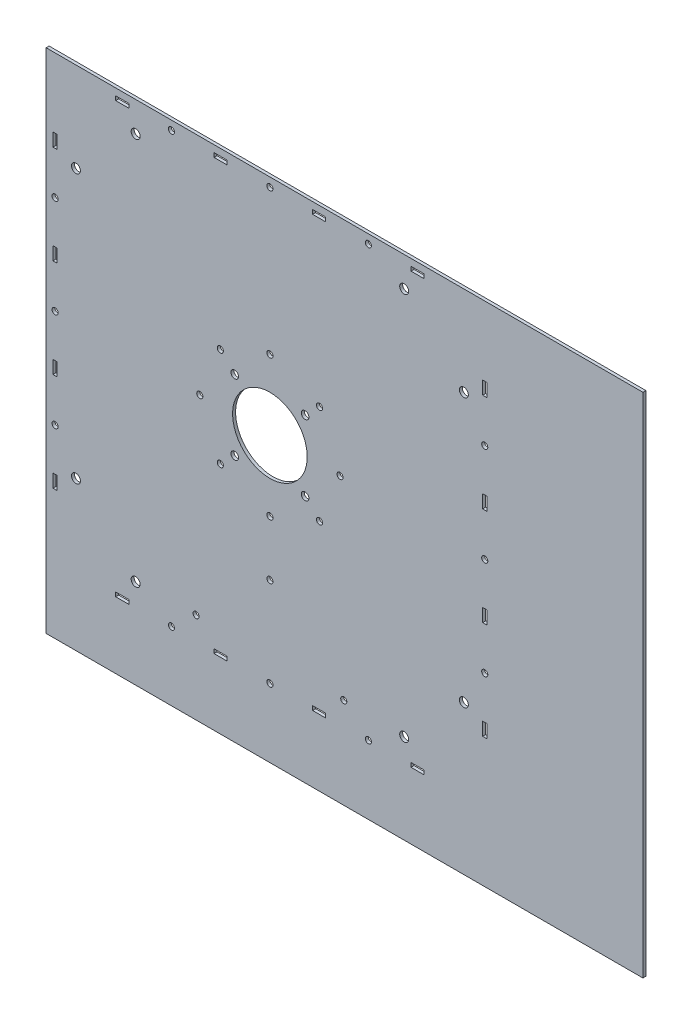
from build123d import *

# Parameters (mm, degrees)
SKETCH_1_R          = 25
SKETCH_1_R_2        = 2.55
EXTRUDE_1_DEPTH     = 2
SKETCH_3_R          = 2.05
SKETCH_3_W          = 8.8
SKETCH_3_H          = 2.8
SKETCH_3_W_2        = 2.8
SKETCH_3_H_2        = 8.8
CUT_EXTRUDE_2_DEPTH = 4
SKETCH_7_R          = 3
CUT_EXTRUDE_3_DEPTH = 10
EXTRUDE_3_DEPTH     = 2


with BuildPart() as part:
    # 草图1 → 凸台-拉伸1 (new body)
    with BuildSketch(Plane.XY):
        Polygon((151.457142857, -41.187142857), (151.457142857, 108.812857143), (-148.542857143, 108.812857143), (-148.542857143, -191.187142857), (151.457142857, -191.187142857), align=None)
        with Locations((1.457142857, -41.187142857)):
            Circle(SKETCH_1_R, mode=Mode.SUBTRACT)
        with Locations((25.027142857, -17.617142857)):
            Circle(SKETCH_1_R_2, mode=Mode.SUBTRACT)
        with Locations((25.027142857, -64.757142857)):
            Circle(SKETCH_1_R_2, mode=Mode.SUBTRACT)
        with Locations((-22.112857143, -64.757142857)):
            Circle(SKETCH_1_R_2, mode=Mode.SUBTRACT)
        with Locations((-22.112857143, -17.617142857)):
            Circle(SKETCH_1_R_2, mode=Mode.SUBTRACT)
    extrude(amount=EXTRUDE_1_DEPTH)

    # 草图3 → 切除-拉伸2 (cut)
    with BuildSketch(Plane.XY.offset(2)):
        with Locations((1.457142857, -185.187142857)):
            Circle(SKETCH_3_R)
        with Locations((67.457142857, -185.187142857)):
            Circle(SKETCH_3_R)
        with Locations((-64.542857143, -185.187142857)):
            Circle(SKETCH_3_R)
        with Locations((-142.542857143, 24.812857143)):
            Circle(SKETCH_3_R)
        with Locations((-142.542857143, -41.187142857)):
            Circle(SKETCH_3_R)
        with Locations((-142.542857143, -107.187142857)):
            Circle(SKETCH_3_R)
        with Locations((67.457142857, 102.812857143)):
            Circle(SKETCH_3_R)
        with Locations((1.457142857, 102.812857143)):
            Circle(SKETCH_3_R)
        with Locations((-64.542857143, 102.812857143)):
            Circle(SKETCH_3_R)
        with Locations((145.457142857, -107.187142857)):
            Circle(SKETCH_3_R)
        with Locations((145.457142857, -41.187142857)):
            Circle(SKETCH_3_R)
        with Locations((145.457142857, 24.812857143)):
            Circle(SKETCH_3_R)
        with Locations((50.957142857, -170.187142857)):
            Circle(SKETCH_3_R)
        with Locations((-48.042857143, -170.187142857)):
            Circle(SKETCH_3_R)
        with Locations((1.457142857, -88.187142857)):
            Circle(SKETCH_3_R)
        with Locations((-31.776875859, -74.421161573)):
            Circle(SKETCH_3_R)
        with Locations((-45.542857143, -41.187142857)):
            Circle(SKETCH_3_R)
        with Locations((-31.776875859, -7.953124141)):
            Circle(SKETCH_3_R)
        with Locations((1.457142857, 5.812857143)):
            Circle(SKETCH_3_R)
        with Locations((34.691161573, -7.953124141)):
            Circle(SKETCH_3_R)
        with Locations((48.457142857, -41.187142857)):
            Circle(SKETCH_3_R)
        with Locations((34.691161573, -74.421161573)):
            Circle(SKETCH_3_R)
        with Locations((1.457142857, -125.187142857)):
            Circle(SKETCH_3_R)
        with Locations((100.457142857, -185.187142857)):
            Rectangle(SKETCH_3_W, SKETCH_3_H)
        with Locations((34.457142857, -185.187142857)):
            Rectangle(SKETCH_3_W, SKETCH_3_H)
        with Locations((-31.542857143, -185.187142857)):
            Rectangle(SKETCH_3_W, SKETCH_3_H)
        with Locations((-97.542857143, -185.187142857)):
            Rectangle(SKETCH_3_W, SKETCH_3_H)
        with Locations((-142.542857143, 57.812857143)):
            Rectangle(SKETCH_3_W_2, SKETCH_3_H_2)
        with Locations((-142.542857143, -8.187142857)):
            Rectangle(SKETCH_3_W_2, SKETCH_3_H_2)
        with Locations((-142.542857143, -74.187142857)):
            Rectangle(SKETCH_3_W_2, SKETCH_3_H_2)
        with Locations((-142.542857143, -140.187142857)):
            Rectangle(SKETCH_3_W_2, SKETCH_3_H_2)
        with Locations((100.457142857, 102.812857143)):
            Rectangle(SKETCH_3_W, SKETCH_3_H)
        with Locations((34.457142857, 102.812857143)):
            Rectangle(SKETCH_3_W, SKETCH_3_H)
        with Locations((-31.542857143, 102.812857143)):
            Rectangle(SKETCH_3_W, SKETCH_3_H)
        with Locations((-97.542857143, 102.812857143)):
            Rectangle(SKETCH_3_W, SKETCH_3_H)
        with Locations((145.457142857, -140.187142857)):
            Rectangle(SKETCH_3_W_2, SKETCH_3_H_2)
        with Locations((145.457142857, -74.187142857)):
            Rectangle(SKETCH_3_W_2, SKETCH_3_H_2)
        with Locations((145.457142857, -8.187142857)):
            Rectangle(SKETCH_3_W_2, SKETCH_3_H_2)
        with Locations((145.457142857, 57.812857143)):
            Rectangle(SKETCH_3_W_2, SKETCH_3_H_2)
    extrude(amount=-CUT_EXTRUDE_2_DEPTH, mode=Mode.SUBTRACT)

    # 草图7 → 切除-拉伸3 (cut)
    with BuildSketch(Plane.XY.offset(2)):
        with Locations((-88.542857143, -171.187142857)):
            Circle(SKETCH_7_R)
        with Locations((91.457142857, -171.187142857)):
            Circle(SKETCH_7_R)
        with Locations((-128.542857143, 48.812857143)):
            Circle(SKETCH_7_R)
        with Locations((-128.542857143, -131.187142857)):
            Circle(SKETCH_7_R)
        with Locations((91.457142857, 88.812857143)):
            Circle(SKETCH_7_R)
        with Locations((-88.542857143, 88.812857143)):
            Circle(SKETCH_7_R)
        with Locations((131.457142857, -131.187142857)):
            Circle(SKETCH_7_R)
        with Locations((131.457142857, 48.812857143)):
            Circle(SKETCH_7_R)
    extrude(amount=-CUT_EXTRUDE_3_DEPTH, mode=Mode.SUBTRACT)

    # 草图9 → 凸台-拉伸3 (add)
    with BuildSketch(Plane.XY.offset(2)):
        Polygon((151.457142857, 108.812857143), (251.457142857, 108.812857143), (251.457142857, -191.187142857), (251.457142857, -231.187142857), (-148.542857143, -231.187142857), (-148.542857143, -191.187142857), (151.457142857, -191.187142857), align=None)
    extrude(amount=-EXTRUDE_3_DEPTH)


solid = part.part
